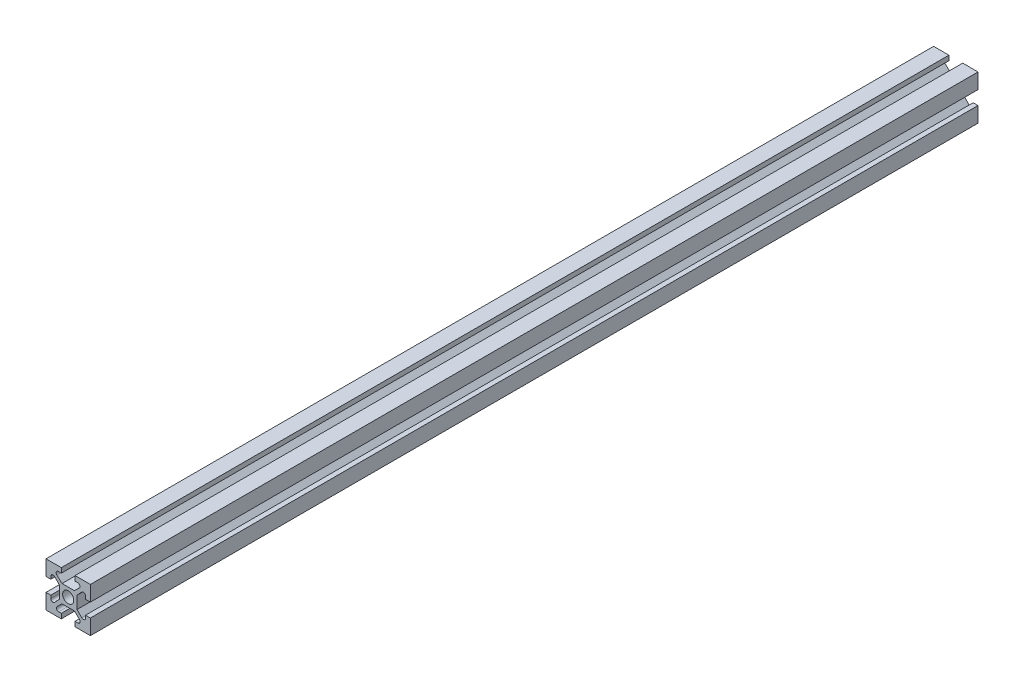
from build123d import *

# Parameters (mm, degrees)
SKETCH2_R           = 2.5
BOSS_EXTRUDE1_DEPTH = 400


with BuildPart() as part:
    # Sketch2 → Boss-Extrude1 (new body)
    with BuildSketch(Plane.XY):
        with BuildLine():
            Line((-10, -10), (-3.1, -10))
            Line((-3.1, -10), (-3.1, -7.81857447))
            Line((-3.1, -7.81857447), (-4.285374034, -7.81857447))
            ThreePointArc((-4.285374034, -7.81857447), (-5.210402021, -7.198473435), (-4.988208383, -6.107220917))
            Line((-4.988208383, -6.107220917), (-2.819718275, -3.96470075))
            Line((-2.819718275, -3.96470075), (0, -3.96470075))
            Line((0, -3.96470075), (2.782738033, -3.96470075))
            Line((2.782738033, -3.96470075), (5.105242131, -6.103332486))
            ThreePointArc((5.105242131, -6.103332486), (5.359419929, -7.202533996), (4.427854938, -7.838959152))
            Line((4.427854938, -7.838959152), (3.1, -7.838959152))
            Line((3.1, -7.838959152), (3.1, -10))
            Line((3.1, -10), (10, -10))
            Line((10, -10), (10, -3.1))
            Line((10, -3.1), (7.81857447, -3.1))
            Line((7.81857447, -3.1), (7.81857447, -4.285374034))
            ThreePointArc((7.81857447, -4.285374034), (7.198473435, -5.210402021), (6.107220917, -4.988208383))
            Line((6.107220917, -4.988208383), (3.96470075, -2.819718275))
            Line((3.96470075, -2.819718275), (3.96470075, 0))
            Line((3.96470075, 0), (3.96470075, 2.782738033))
            Line((3.96470075, 2.782738033), (6.103332486, 5.105242131))
            ThreePointArc((6.103332486, 5.105242131), (7.202533996, 5.359419929), (7.838959152, 4.427854938))
            Line((7.838959152, 4.427854938), (7.838959152, 3.1))
            Line((7.838959152, 3.1), (10, 3.1))
            Line((10, 3.1), (10, 10))
            Line((10, 10), (3.1, 10))
            Line((3.1, 10), (3.1, 7.81857447))
            Line((3.1, 7.81857447), (4.285374034, 7.81857447))
            ThreePointArc((4.285374034, 7.81857447), (5.210402021, 7.198473435), (4.988208383, 6.107220917))
            Line((4.988208383, 6.107220917), (2.819718275, 3.96470075))
            Line((2.819718275, 3.96470075), (0, 3.96470075))
            Line((0, 3.96470075), (-2.782738033, 3.96470075))
            Line((-2.782738033, 3.96470075), (-5.105242131, 6.103332486))
            ThreePointArc((-5.105242131, 6.103332486), (-5.359419929, 7.202533996), (-4.427854938, 7.838959152))
            Line((-4.427854938, 7.838959152), (-3.1, 7.838959152))
            Line((-3.1, 7.838959152), (-3.1, 10))
            Line((-3.1, 10), (-10, 10))
            Line((-10, 10), (-10, 3.1))
            Line((-10, 3.1), (-7.81857447, 3.1))
            Line((-7.81857447, 3.1), (-7.81857447, 4.285374034))
            ThreePointArc((-7.81857447, 4.285374034), (-7.198473435, 5.210402021), (-6.107220917, 4.988208383))
            Line((-6.107220917, 4.988208383), (-3.96470075, 2.819718275))
            Line((-3.96470075, 2.819718275), (-3.96470075, 0))
            Line((-3.96470075, 0), (-3.96470075, -2.782738033))
            Line((-3.96470075, -2.782738033), (-6.103332486, -5.105242131))
            ThreePointArc((-6.103332486, -5.105242131), (-7.202533996, -5.359419929), (-7.838959152, -4.427854938))
            Line((-7.838959152, -4.427854938), (-7.838959152, -3.1))
            Line((-7.838959152, -3.1), (-10, -3.1))
            Line((-10, -3.1), (-10, -10))
        make_face()
        Circle(SKETCH2_R, mode=Mode.SUBTRACT)
    extrude(amount=BOSS_EXTRUDE1_DEPTH)


solid = part.part
